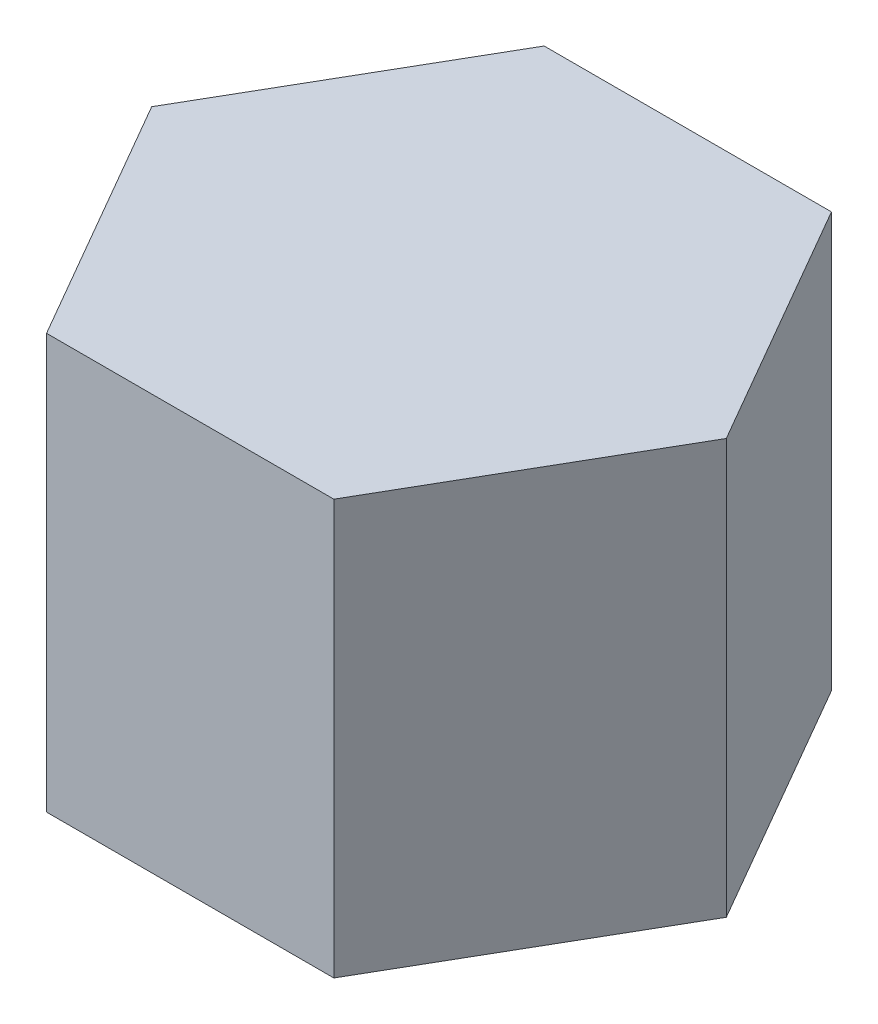
from build123d import *

# Parameters (mm, degrees)
EXTRUDE_1_DEPTH = 25


with BuildPart() as part:
    # 草图3 → 凸台-拉伸1 (new body)
    with BuildSketch(Plane(origin=(0, 0, 0), x_dir=(1, 0, 0), z_dir=(0, 1, 0))):
        Polygon((23.660254038, 0), (6.339745962, 0), (-2.320508076, -15), (6.339745962, -30), (23.660254038, -30), (32.320508076, -15), align=None)
    extrude(amount=EXTRUDE_1_DEPTH)


solid = part.part
